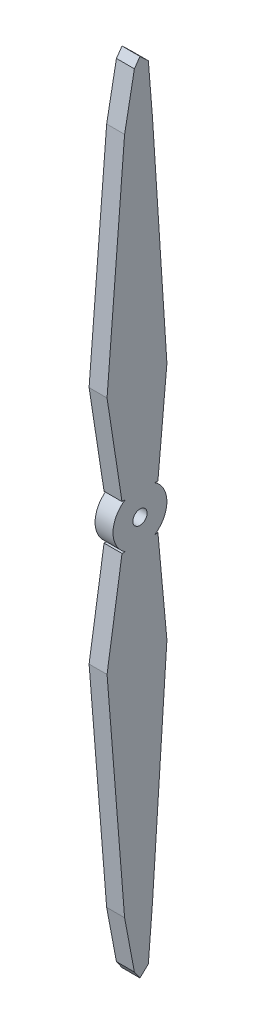
from build123d import *

# Parameters (mm, degrees)
BOSS_EXTRUDE1_DEPTH     = 8
BOSS_EXTRUDE1_2_DEPTH   = 8
SKETCH2_R               = 12
BOSS_EXTRUDE2_DEPTH     = 8
CUT_EXTRUDE1_DEPTH      = 179.583327588
CUT_EXTRUDE1_DEPTH_BACK = 179.583327588
SKETCH3_R               = 3.175


with BuildPart() as part:
    # Sketch1 → Boss-Extrude1 (new body)
    with BuildSketch(Plane(origin=(0, 0, 0), x_dir=(0, 0, -1), z_dir=(1, 0, 0))):
        Polygon((-8.001, 10), (-14.6685, 53.34), (-6.8453, 151.13), (-2.4892, 174.244), (0, 177.8), (3.7338, 174.244), (5.6007, 151.13), (12.0015, 53.34), (8.001, 10), align=None)
    extrude(amount=-BOSS_EXTRUDE1_DEPTH)



with BuildPart() as body_2:
    # Sketch1 → Boss-Extrude1 2 (new body)
    with BuildSketch(Plane(origin=(0, 0, 0), x_dir=(0, 0, -1), z_dir=(1, 0, 0))):
        Polygon((-8.001, -10), (-14.6685, -53.34), (-6.8453, -151.13), (-2.4892, -174.244), (0, -177.8), (3.7338, -174.244), (5.6007, -151.13), (12.0015, -53.34), (8.001, -10), align=None)
    extrude(amount=-BOSS_EXTRUDE1_2_DEPTH)


with BuildPart() as part_1:
    add(part.part)

    add(body_2.part)  # Boss-Extrude2 merges body 2
    # Sketch2 → Boss-Extrude2 (add)
    with BuildSketch(Plane(origin=(0, 0, 0), x_dir=(0, 0, -1), z_dir=(1, 0, 0))):
        Circle(SKETCH2_R)
    extrude(amount=-BOSS_EXTRUDE2_DEPTH)

    # Sketch3 → Cut-Extrude1 (cut, two sides: drawn at the far end of the back side and taken through both)
    with BuildSketch(Plane(origin=(0, 0, 0), x_dir=(0, 0, -1), z_dir=(1, 0, 0)).offset(-CUT_EXTRUDE1_DEPTH_BACK)):
        Circle(SKETCH3_R)
    extrude(amount=CUT_EXTRUDE1_DEPTH + CUT_EXTRUDE1_DEPTH_BACK, mode=Mode.SUBTRACT)


solid = part_1.part
